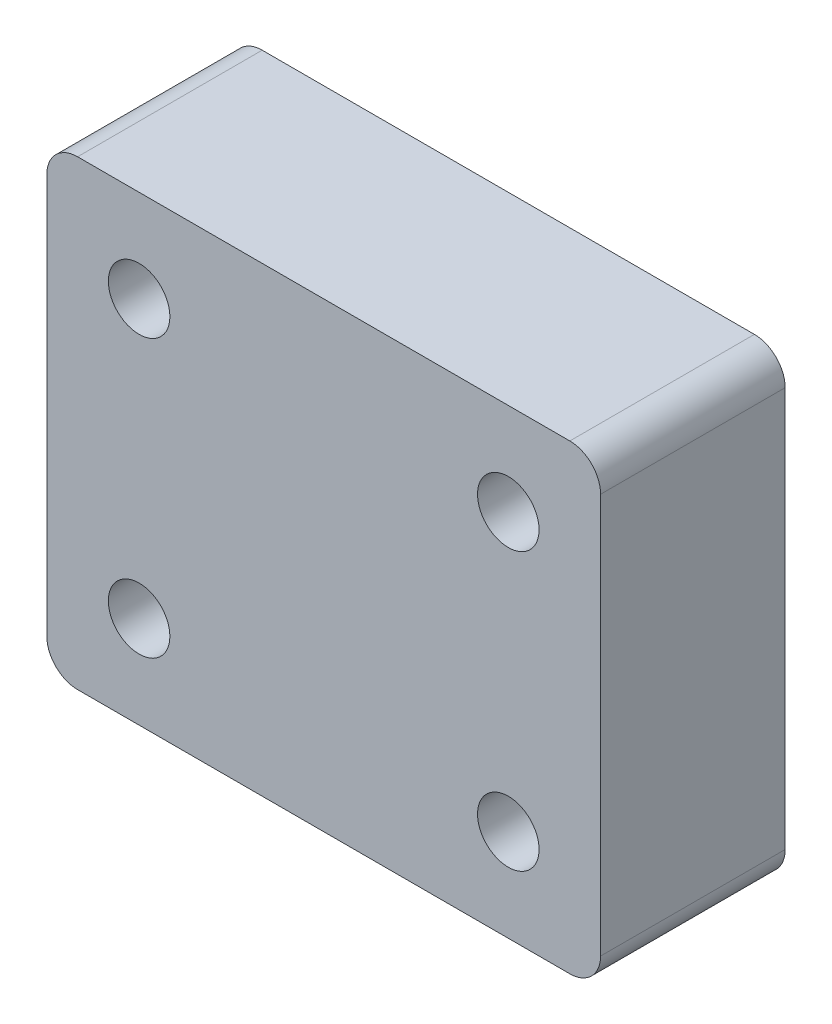
from build123d import *

# Parameters (mm, degrees)
SZKIC1_W                    = 36
SZKIC1_H                    = 30
DODANIE_WYCI_GNI_CIE1_DEPTH = 12
SZKIC2_R                    = 2
WYTNIJ_WYCI_GNI_CIE1_DEPTH  = 12
ZAOKR_GLENIE1_R             = 2


with BuildPart() as part:
    # Szkic1 → Dodanie-wyciągnięcie1 (new body)
    with BuildSketch(Plane.XY):
        with Locations((17, 15)):
            Rectangle(SZKIC1_W, SZKIC1_H)
    extrude(amount=DODANIE_WYCI_GNI_CIE1_DEPTH)

    # Szkic2 → Wytnij-wyciągnięcie1 (cut)
    with BuildSketch(Plane.XY.offset(12)):
        with Locations((5, 6)):
            Circle(SZKIC2_R)
        with Locations((29, 6)):
            Circle(SZKIC2_R)
        with Locations((29, 24)):
            Circle(SZKIC2_R)
        with Locations((5, 24)):
            Circle(SZKIC2_R)
    extrude(amount=-WYTNIJ_WYCI_GNI_CIE1_DEPTH, mode=Mode.SUBTRACT)

    # Zaokrąglenie1
    zaokr_glenie1_edges = [part.edges().sort_by_distance(p)[0] for p in [
        (-1, 30, 6),
        (35, 30, 6),
        (35, 0, 6),
        (-1, 0, 6),
    ]]
    fillet(zaokr_glenie1_edges, radius=ZAOKR_GLENIE1_R)


solid = part.part
